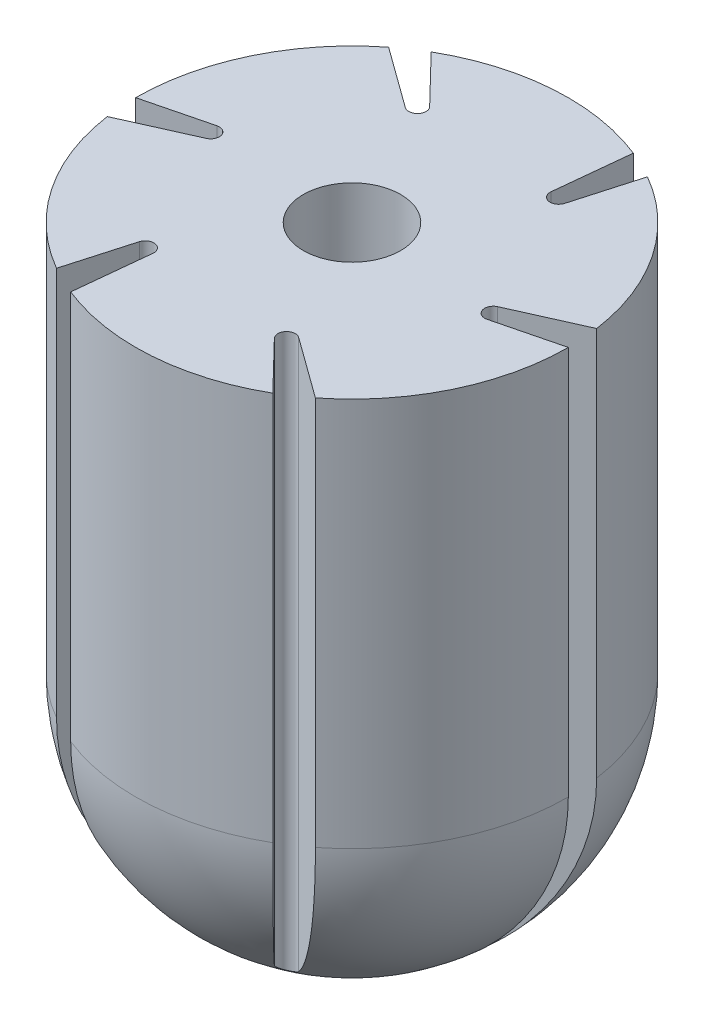
from build123d import *

# Parameters (mm, degrees)
CUT_EXTRUDE1_DEPTH = 16.684387141
CIRPATTERN1_COUNT  = 6


with BuildPart() as part:
    # Sketch1 → Revolve1 (revolve)
    with BuildSketch(Plane.XY):
        with BuildLine():
            Line((-5, 9), (-1.125, 9))
            Line((-1.125, 9), (-1.125, 4))
            Line((-1.125, 4), (0, 4))
            Line((0, 4), (0, -5))
            ThreePointArc((0, -5), (-3.535533906, -3.535533906), (-5, 0))
            Line((-5, 0), (-5, 9))
        make_face()
    revolve(axis=Axis((0, 0, 0), (0, 1, 0)))

    # Sketch2 → Cut-Extrude1 (cut, through all)
    with BuildSketch(Plane(origin=(0, 9, 0), x_dir=(1, 0, 0), z_dir=(0, 1, 0))):
        with BuildLine():
            Line((-4.94979148, -0.706798632), (-3.36819132, 0))
            ThreePointArc((-3.36819132, 0), (-3.260778077, 0.247971643), (-3.498444432, 0.376588299))
            Line((-3.498444432, 0.376588299), (-5, 0))
            ThreePointArc((-5, 0), (-4.987432075, -0.354289854), (-4.94979148, -0.706798632))
        make_face()
    cut_extrude1 = extrude(amount=-CUT_EXTRUDE1_DEPTH, mode=Mode.SUBTRACT)

    # CirPattern1: Cut-Extrude1 ×6 about axis
    cirpattern1_axis = Axis((0, 9, 0), (0, -1, 0))
    for i in range(1, CIRPATTERN1_COUNT):
        add(cut_extrude1.rotate(cirpattern1_axis, i * 360 / CIRPATTERN1_COUNT), mode=Mode.SUBTRACT)


solid = part.part
